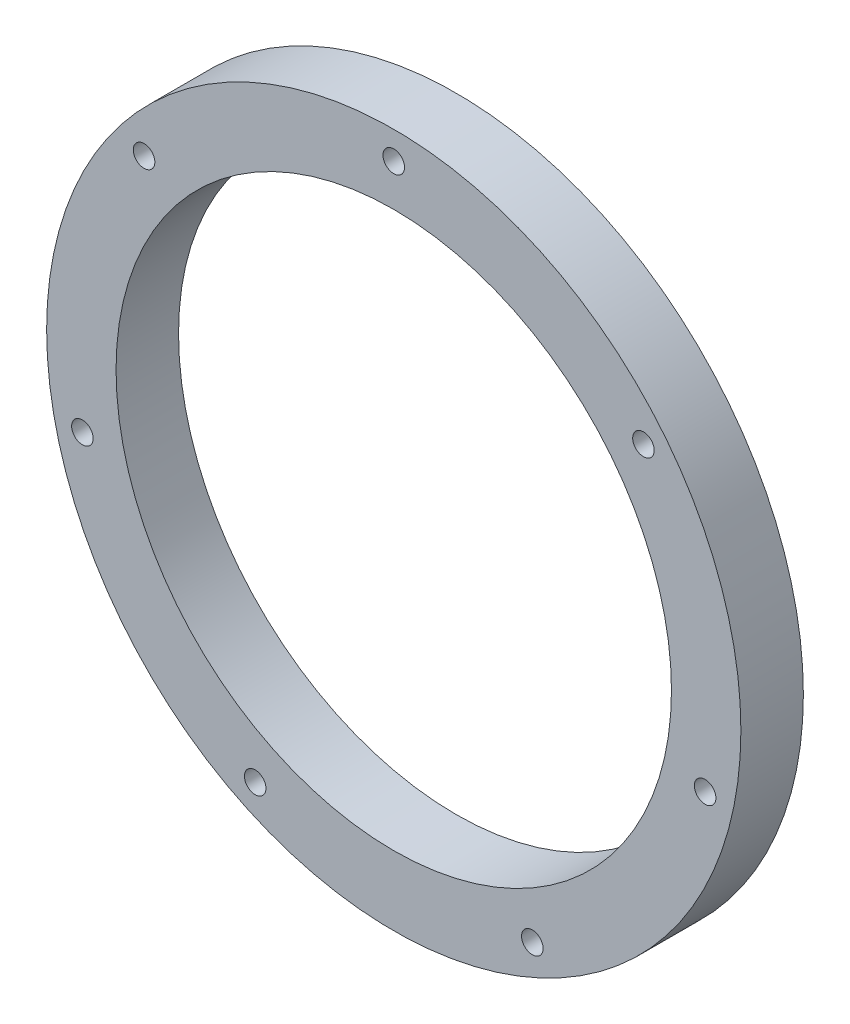
from build123d import *

# Parameters (mm, degrees)
SKIZZE1_R                        = 50
SKIZZE1_R_2                      = 40
AUFSATZ_LINEAR_AUSTRAGEN1_DEPTH  = 9
F_3_1_3_1_DURCHMESSER_BOHRUNG1_D = 3.1
KREISMUSTER1_COUNT               = 7
SKIZZE4_R                        = 3.1
SCHNITT_LINEAR_AUSTRAGEN1_DEPTH  = 3.3
KREISMUSTER2_COUNT               = 7


with BuildPart() as part:
    # Skizze1 → Aufsatz-Linear austragen1 (new body)
    with BuildSketch(Plane.XY):
        Circle(SKIZZE1_R)
        Circle(SKIZZE1_R_2, mode=Mode.SUBTRACT)
    extrude(amount=AUFSATZ_LINEAR_AUSTRAGEN1_DEPTH)

    # Ø3.1 (3.1) Durchmesser Bohrung1 (through all)
    with Locations(Plane.XY.offset(9)):
        with Locations((0, 46)):
            f_3_1_3_1_durchmesser_bohrung1 = Hole(F_3_1_3_1_DURCHMESSER_BOHRUNG1_D / 2)

    # Kreismuster1: Ø3.1 (3.1) Durchmesser Bohrung1 ×7 about axis
    kreismuster1_axis = Axis((0, 0, 0), (0, 0, 1))
    for i in range(1, KREISMUSTER1_COUNT):
        add(f_3_1_3_1_durchmesser_bohrung1.rotate(kreismuster1_axis, i * 360 / KREISMUSTER1_COUNT), mode=Mode.SUBTRACT)

    # Skizze4 → Schnitt-Linear austragen1 (cut)
    with BuildSketch(Plane.XY):
        with Locations((0, 46)):
            Circle(SKIZZE4_R)
    schnitt_linear_austragen1 = extrude(amount=SCHNITT_LINEAR_AUSTRAGEN1_DEPTH, mode=Mode.SUBTRACT)

    # Kreismuster2: Schnitt-Linear austragen1 ×7 about axis
    kreismuster2_axis = Axis((0, 0, 0), (0, 0, 1))
    for i in range(1, KREISMUSTER2_COUNT):
        add(schnitt_linear_austragen1.rotate(kreismuster2_axis, i * 360 / KREISMUSTER2_COUNT), mode=Mode.SUBTRACT)


solid = part.part
